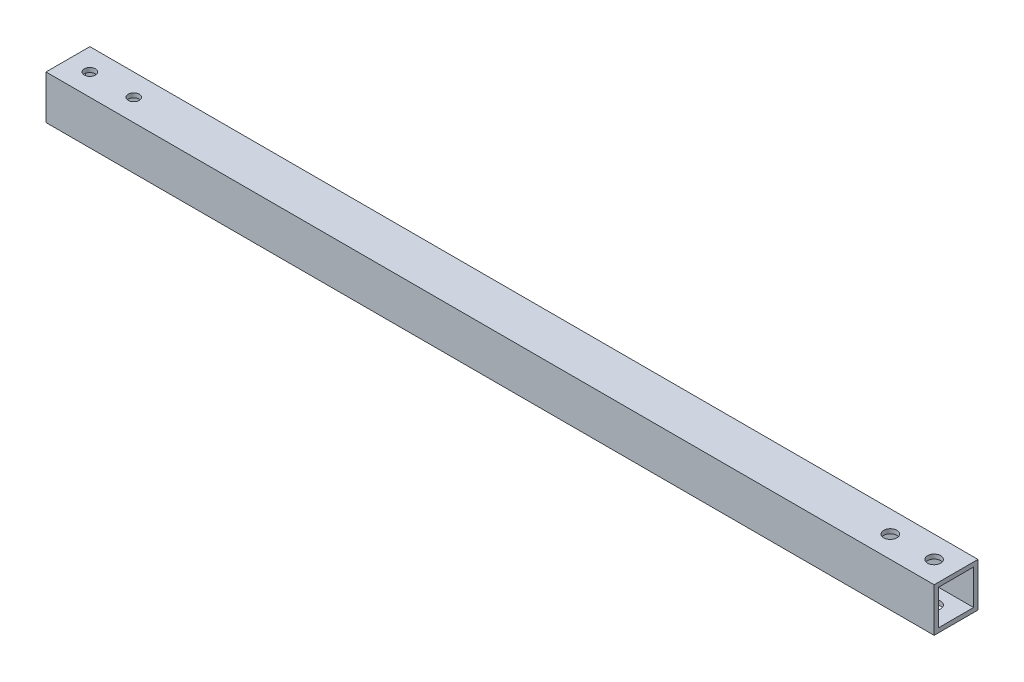
from build123d import *

# Parameters (mm, degrees)
SKETCH1_W           = 20
SKETCH1_H           = 20
SKETCH1_W_2         = 16
SKETCH1_H_2         = 16
BOSS_EXTRUDE1_DEPTH = 202.5
SKETCH2_R           = 3
CUT_EXTRUDE1_DEPTH  = 204.730827319
SKETCH3_R           = 2.5
CUT_EXTRUDE2_DEPTH  = 204.730827319


with BuildPart() as part:
    # Sketch1 → Boss-Extrude1 (new, symmetric)
    with BuildSketch(Plane(origin=(0, 0, 0), x_dir=(0, 0, -1), z_dir=(1, 0, 0))):
        Rectangle(SKETCH1_W, SKETCH1_H)
        Rectangle(SKETCH1_W_2, SKETCH1_H_2, mode=Mode.SUBTRACT)
    extrude(amount=BOSS_EXTRUDE1_DEPTH, both=True)

    # Sketch2 → Cut-Extrude1 (cut, through all)
    with BuildSketch(Plane(origin=(0, 10, 0), x_dir=(1, 0, 0), z_dir=(0, 1, 0))):
        with Locations(Location((192.5, 0, 0), (0, 0, 270))):
            Circle(SKETCH2_R)
        with Locations(Location((172.5, 0, 0), (0, 0, 270))):
            Circle(SKETCH2_R)
    extrude(amount=-CUT_EXTRUDE1_DEPTH, mode=Mode.SUBTRACT)

    # Sketch3 → Cut-Extrude2 (cut, through all)
    with BuildSketch(Plane(origin=(0, 10, 0), x_dir=(1, 0, 0), z_dir=(0, 1, 0))):
        with Locations(Location((-192.5, 0, 0), (0, 0, 270))):
            Circle(SKETCH3_R)
        with Locations(Location((-172.5, 0, 0), (0, 0, 270))):
            Circle(SKETCH3_R)
    extrude(amount=-CUT_EXTRUDE2_DEPTH, mode=Mode.SUBTRACT)


solid = part.part
